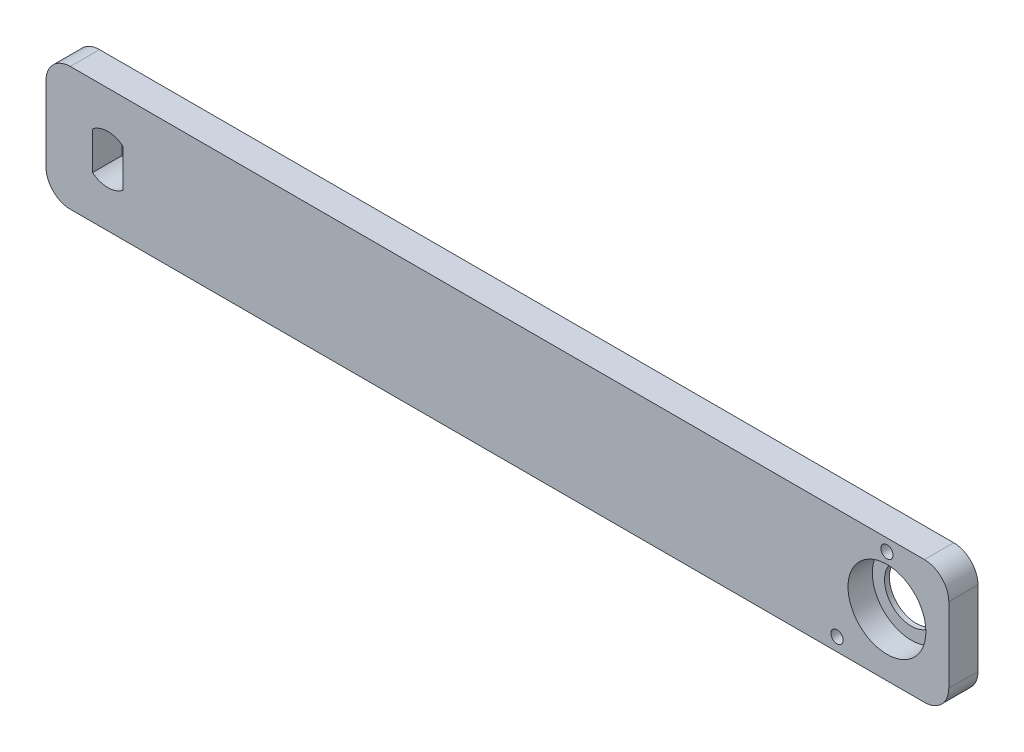
from build123d import *

# Parameters (mm, degrees)
CROQUIS1_W              = 370.8
CROQUIS1_H              = 50.8
CROQUIS1_R              = 11
SALIENTE_EXTRUIR1_DEPTH = 12
REDONDEO1_R             = 10
CROQUIS4_R              = 16
CORTAR_EXTRUIR3_DEPTH   = 10
CROQUIS6_R              = 2.5
CORTAR_EXTRUIR4_DEPTH   = 347.540502683


with BuildPart() as part:
    # Croquis1 → Saliente-Extruir1 (new body)
    with BuildSketch(Plane.XY):
        with Locations((160, 0)):
            Rectangle(CROQUIS1_W, CROQUIS1_H)
        with Locations((320, 0)):
            Circle(CROQUIS1_R, mode=Mode.SUBTRACT)
        with BuildLine():
            Line((-6.28, -7.782133384), (-6.28, 7.782133384))
            ThreePointArc((-6.28, 7.782133384), (0, 10), (6.28, 7.782133384))
            Line((6.28, 7.782133384), (6.28, -7.782133384))
            ThreePointArc((6.28, -7.782133384), (0, -10), (-6.28, -7.782133384))
        make_face(mode=Mode.SUBTRACT)
    extrude(amount=SALIENTE_EXTRUIR1_DEPTH)

    # Redondeo1
    redondeo1_edges = [part.edges().sort_by_distance(p)[0] for p in [
        (-25.4, 25.4, 6),
        (345.4, 25.4, 6),
        (345.4, -25.4, 6),
        (-25.4, -25.4, 6),
    ]]
    fillet(redondeo1_edges, radius=REDONDEO1_R)

    # Croquis4 → Cortar-Extruir3 (cut)
    with BuildSketch(Plane.XY.offset(12)):
        with Locations((320, 0)):
            Circle(CROQUIS4_R)
    extrude(amount=-CORTAR_EXTRUIR3_DEPTH, mode=Mode.SUBTRACT)

    # Croquis6 → Cortar-Extruir4 (cut, through all)
    with BuildSketch(Plane.XY.offset(12)):
        with Locations((320, 20.5)):
            Circle(CROQUIS6_R)
        with Locations((360.5, 0)):
            Circle(CROQUIS6_R)
        with Locations((340, -40.5)):
            Circle(CROQUIS6_R)
        with Locations((299.5, -20)):
            Circle(CROQUIS6_R)
    extrude(amount=-CORTAR_EXTRUIR4_DEPTH, mode=Mode.SUBTRACT)


solid = part.part
